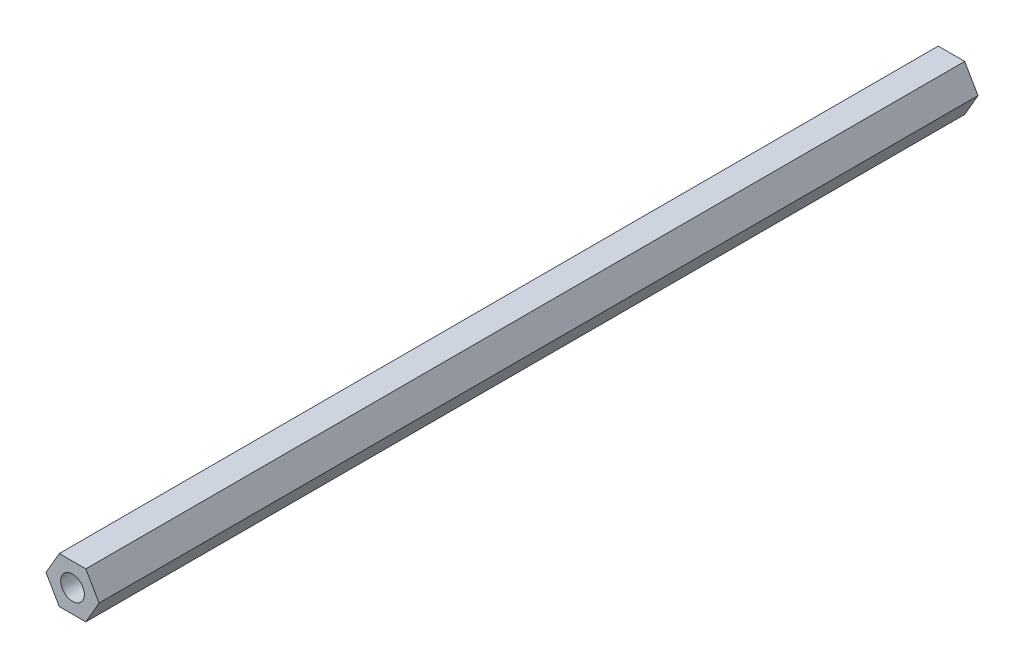
from build123d import *

# Parameters (mm, degrees)
SKETCH1_R           = 3.2639
BOSS_EXTRUDE1_DEPTH = 242.824


with BuildPart() as part:
    # Sketch1 → Boss-Extrude1 (new body)
    with BuildSketch(Plane.XY):
        Polygon((-7.332348419, 0), (-3.666174209, -6.35), (3.666174209, -6.35), (7.332348419, 0), (3.666174209, 6.35), (-3.666174209, 6.35), align=None)
        Circle(SKETCH1_R, mode=Mode.SUBTRACT)
    extrude(amount=BOSS_EXTRUDE1_DEPTH)


solid = part.part
